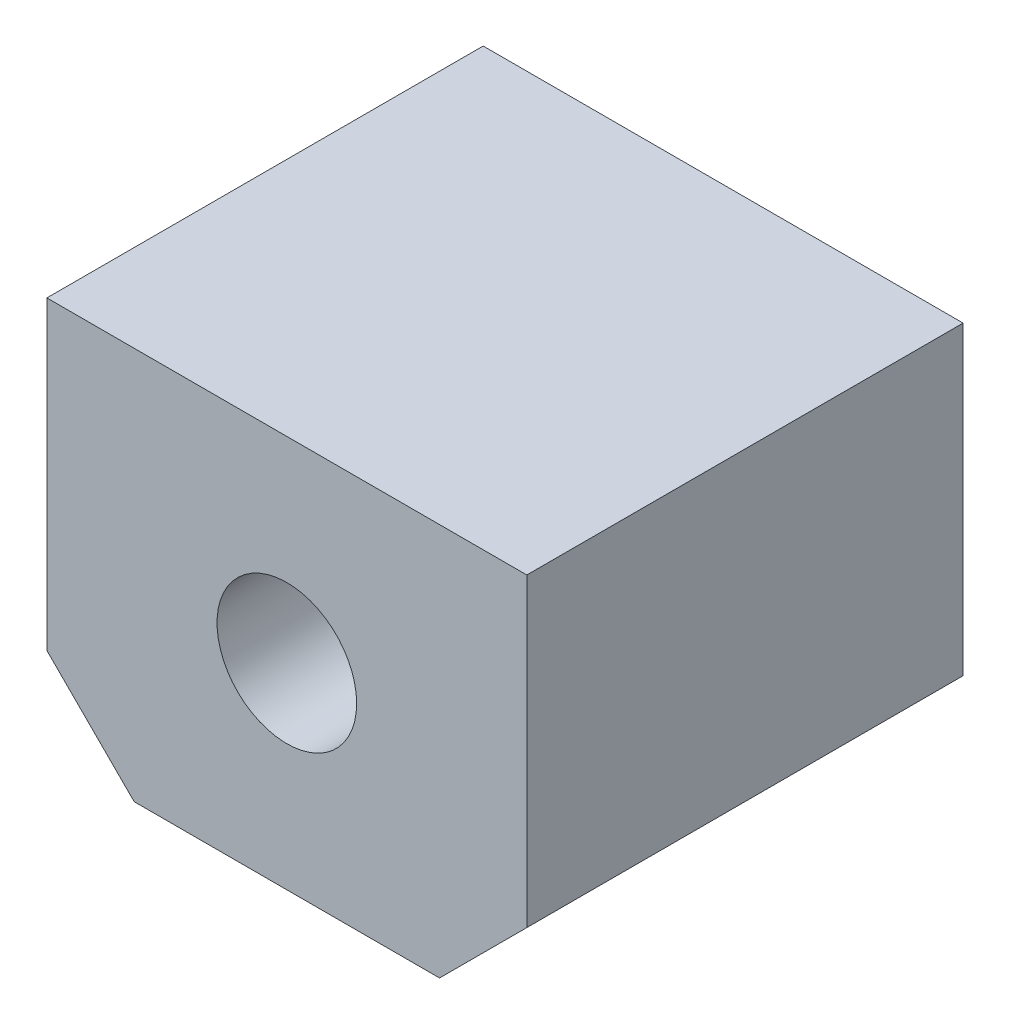
from build123d import *

# Parameters (mm, degrees)
CROQUIS1_R              = 8
SALIENTE_EXTRUIR1_DEPTH = 50


with BuildPart() as part:
    # Croquis1 → Saliente-Extruir1 (new body)
    with BuildSketch(Plane.XY):
        Polygon((-17.5, -22.5), (-27.5, -12.5), (-27.5, 22.5), (27.5, 22.5), (27.5, -12.5), (17.5, -22.5), align=None)
        Circle(CROQUIS1_R, mode=Mode.SUBTRACT)
    extrude(amount=SALIENTE_EXTRUIR1_DEPTH)


solid = part.part
